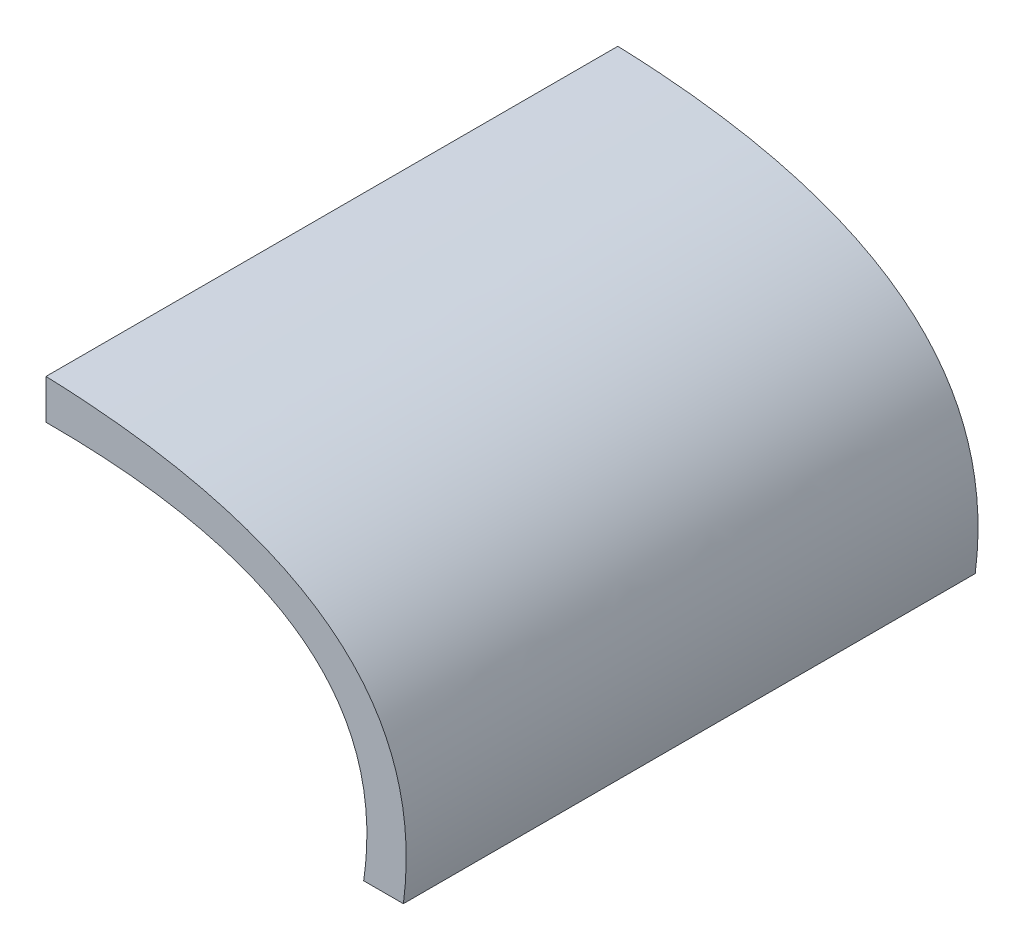
from build123d import *

# Parameters (mm, degrees)
BOSS_EXTRUDE1_DEPTH = 72


with BuildPart() as part:
    # Sketch1 → Boss-Extrude1 (new body)
    with BuildSketch(Plane.XY):
        with BuildLine():
            Line((0, 35), (0, 30))
            add(Edge.make_bspline(
                [(0, 30), (44.472135955, 30.124611797), (40, 0)],
                knots=[0, 0, 0, 1, 1, 1], degree=2))
            Line((40, 0), (45, 0))
            add(Edge.make_bspline(
                [(0, 35), (49.370786381, 33.310860697), (45, 0)],
                knots=[0, 0, 0, 1, 1, 1], degree=2))
        make_face()
    extrude(amount=BOSS_EXTRUDE1_DEPTH)


solid = part.part
